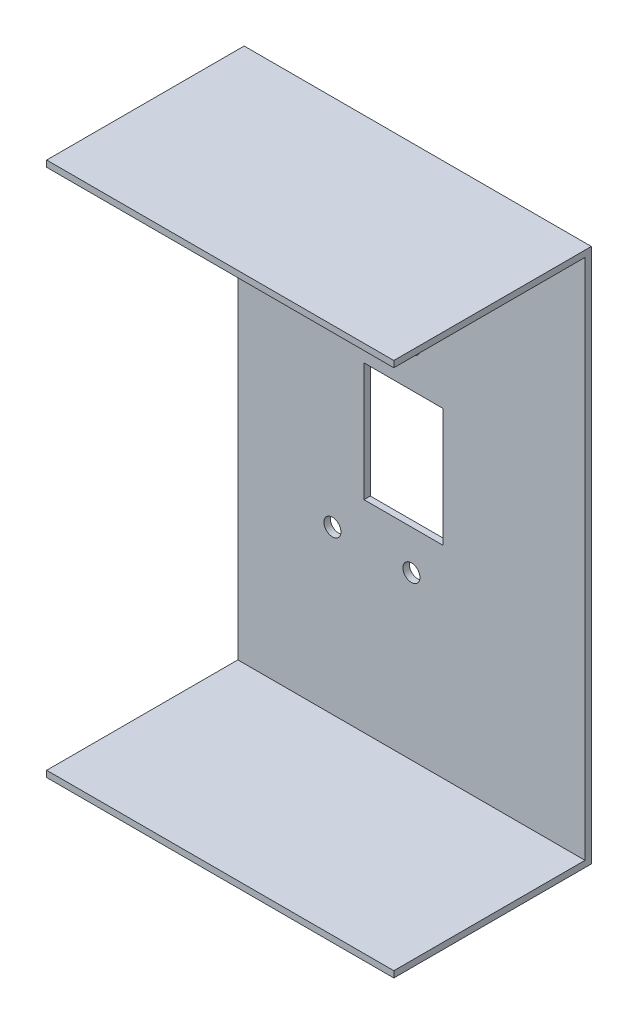
from build123d import *

# Parameters (mm, degrees)
BOSS_EXTRUDE1_DEPTH = 87.89068
SKETCH2_R           = 2.155
SKETCH2_W           = 20
SKETCH2_H           = 30
CUT_EXTRUDE1_DEPTH  = 1.6002


with BuildPart() as part:
    # Sketch1 → Boss-Extrude1 (new body)
    with BuildSketch(Plane(origin=(0, 0, 0), x_dir=(0, 0, -1), z_dir=(1, 0, 0))):
        Polygon((0, 0), (0, -1.6002), (48.3998, -1.6002), (48.3998, -133.7877), (0, -133.7877), (0, -135.3879), (50, -135.3879), (50, 0), align=None)
    extrude(amount=BOSS_EXTRUDE1_DEPTH)

    # Sketch2 → Cut-Extrude1 (cut)
    with BuildSketch(Plane.XY.offset(-48.3998)):
        with Locations((23.94534, -92.69395)):
            Circle(SKETCH2_R)
        with Locations((23.94534, -42.69395)):
            Circle(SKETCH2_R)
        with Locations((43.94534, -92.69395)):
            Circle(SKETCH2_R)
        with Locations((43.94534, -42.69395)):
            Circle(SKETCH2_R)
        with Locations((41.94534, -67.69395)):
            Rectangle(SKETCH2_W, SKETCH2_H)
    extrude(amount=-CUT_EXTRUDE1_DEPTH, mode=Mode.SUBTRACT)


solid = part.part
